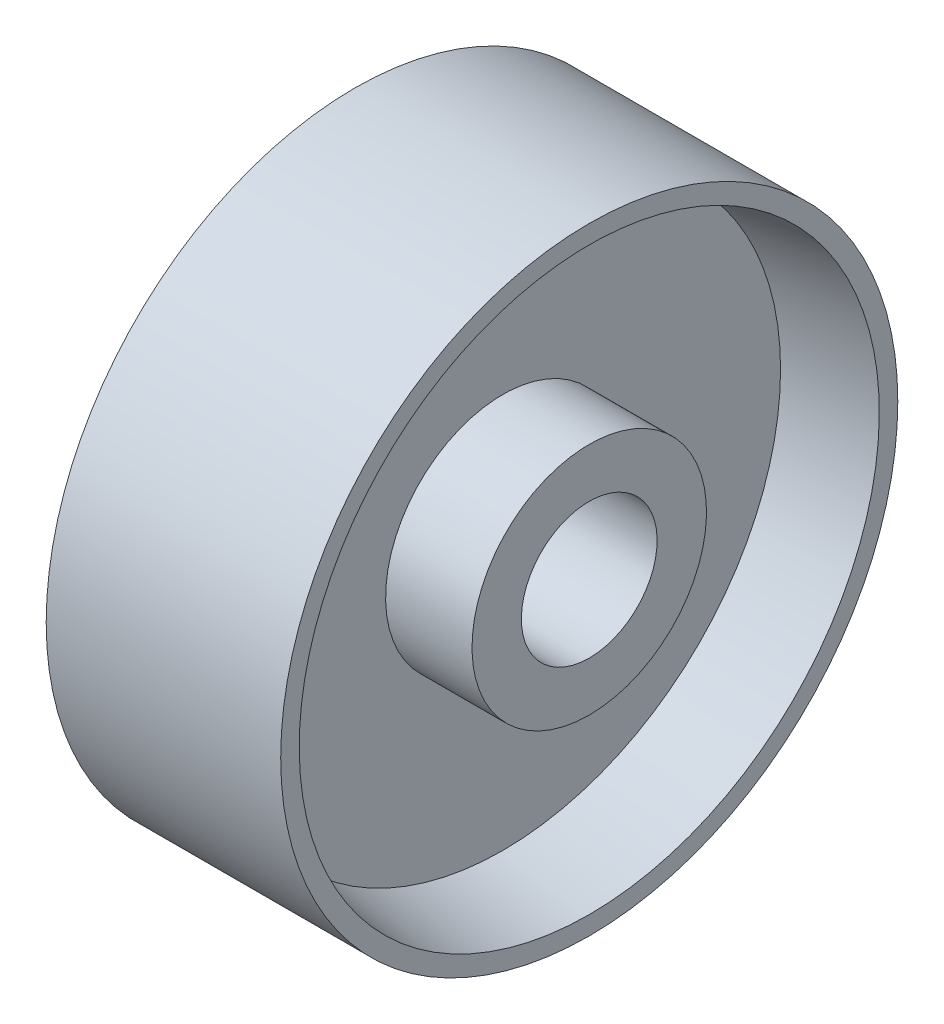
from build123d import *


with BuildPart() as part:
    # Esquisse1 → Révolution1 (revolve)
    with BuildSketch(Plane.XY):
        Polygon((19, -11), (-19, -11), (-19, -19), (-5, -19), (-5, -45), (-19, -47), (-19, -50), (19, -50), (19, -47), (5, -45), (5, -19), (19, -19), align=None)
    revolve(axis=Axis((-25, 0, 0), (1, 0, 0)))


solid = part.part
